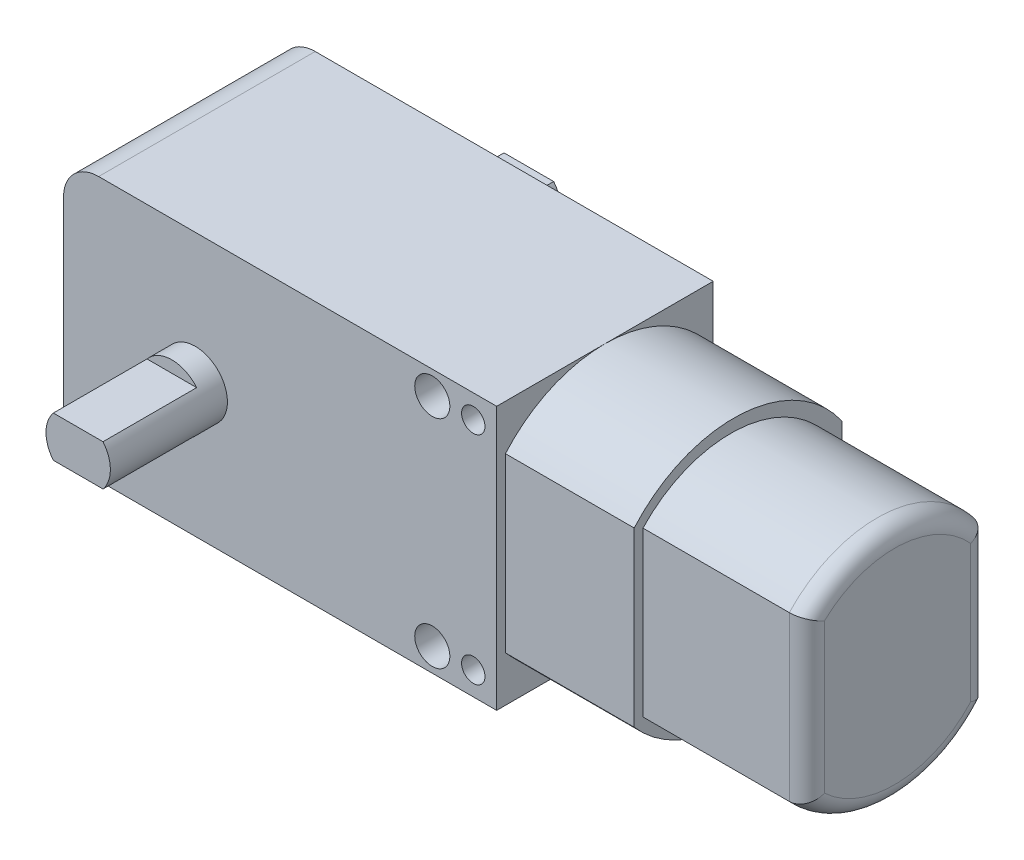
from build123d import *

# Parameters (mm, degrees)
EXTRUDE_1_DEPTH        = 18.5
ESQUISSE2_R            = 11.25
EXTRUDE_2_DEPTH        = 11
ESQUISSE3_W            = 7.263563502
ESQUISSE3_H            = 23
CUT_EXTRUDE_1_DEPTH    = 11
ESQUISSE4_W            = 3.250647349
ESQUISSE4_H            = 22.420209618
CUT_EXTRUDE_2_DEPTH    = 11
EXTRUDE_3_DEPTH        = 14
FILLET_1634_R          = 1.5
ESQUISSE6_R            = 2.75
EXTRUDE_2111_DEPTH     = 10
ESQUISSE7_W            = 6.523740903
ESQUISSE7_H            = 2.038669032
ESQUISSE7_W_2          = 7.224194277
ESQUISSE7_H_2          = 1.666034325
CUT_EXTRUDE_2259_DEPTH = 8
ESQUISSE8_W            = 3
ESQUISSE8_H            = 5
EXTRUDE_2603_DEPTH     = 4.5
CUT_EXTRUDE_4_REACH    = 71.143
ESQUISSE9_R            = 1
ESQUISSE10_R           = 1.5
ESQUISSE10_R_2         = 1
CUT_EXTRUDE_5_DEPTH    = 18.5
ESQUISSE11_R           = 2
EXTRUDE_4_DEPTH        = 2
FILLET_2_R             = 0.2


with BuildPart() as part:
    # Esquisse1 → Бобышка 1 (new body)
    with BuildSketch(Plane.XY):
        with BuildLine():
            Line((3, 0), (37, 0))
            Line((37, 0), (37, 22.5))
            Line((37, 22.5), (3, 22.5))
            ThreePointArc((3, 22.5), (0.878679656, 21.621320344), (0, 19.5))
            Line((0, 19.5), (0, 3))
            ThreePointArc((0, 3), (0.878679656, 0.878679656), (3, 0))
        make_face()
    extrude(amount=-EXTRUDE_1_DEPTH)

    # Esquisse2 → Бобышка 2 (add)
    with BuildSketch(Plane(origin=(37, 0, 0), x_dir=(0, 0, -1), z_dir=(1, 0, 0))):
        with Locations(Location((9.25, 11.25, 0), (0, 0, 90))):
            Circle(ESQUISSE2_R)
    extrude(amount=EXTRUDE_2_DEPTH)

    # Esquisse3 → Вырез 1 (cut)
    with BuildSketch(Plane(origin=(48, 0, 0), x_dir=(0, 0, -1), z_dir=(1, 0, 0))):
        with Locations((-2.881781751, 11.206610827)):
            Rectangle(ESQUISSE3_W, ESQUISSE3_H)
    extrude(amount=-CUT_EXTRUDE_1_DEPTH, mode=Mode.SUBTRACT)

    # Esquisse4 → Вырез 2 (cut)
    with BuildSketch(Plane(origin=(48, 0, 0), x_dir=(0, 0, -1), z_dir=(1, 0, 0))):
        with Locations((20.125323675, 11.210104809)):
            Rectangle(ESQUISSE4_W, ESQUISSE4_H)
    extrude(amount=-CUT_EXTRUDE_2_DEPTH, mode=Mode.SUBTRACT)

    # Esquisse5 → Бобышка 3 (add)
    with BuildSketch(Plane(origin=(48, 0, 0), x_dir=(0, 0, -1), z_dir=(1, 0, 0))):
        with BuildLine():
            Line((1.5, 18.236594306), (1.5, 4.263405694))
            ThreePointArc((1.5, 4.263405694), (9.382350664, 1.007133801), (17, 4.841997191))
            Line((17, 4.841997191), (17, 17.658002809))
            ThreePointArc((17, 17.658002809), (9.382350664, 21.492866199), (1.5, 18.236594306))
        make_face()
    extrude(amount=EXTRUDE_3_DEPTH)

    # Fillet 1634
    fillet_1634_edges = [part.edges().sort_by_distance(p)[0] for p in [
        (62, 21.492866199, -9.382350664),
        (62, 11.25, -1.5),
        (62, 1.007133801, -9.382350664),
        (62, 11.25, -17),
    ]]
    fillet(fillet_1634_edges, radius=FILLET_1634_R)

    # Esquisse6 → Extrude 2111 (add)
    with BuildSketch(Plane(origin=(0, 0, -18.5), x_dir=(-1, 0, 0), z_dir=(0, 0, -1))):
        with Locations(Location((-11.25, 11.315637883, 0), (0, 0, 180))):
            Circle(ESQUISSE6_R)
    extrude_2111 = extrude(amount=EXTRUDE_2111_DEPTH)

    # Esquisse7 → Cut-Extrude 2259 (cut)
    with BuildSketch(Plane(origin=(0, 0, -28.5), x_dir=(-1, 0, 0), z_dir=(0, 0, -1))):
        with Locations((-11.211063993, 14.084972399)):
            Rectangle(ESQUISSE7_W, ESQUISSE7_H)
        with Locations((-10.860837306, 8.732620721)):
            Rectangle(ESQUISSE7_W_2, ESQUISSE7_H_2)
    cut_extrude_2259 = extrude(amount=-CUT_EXTRUDE_2259_DEPTH, mode=Mode.SUBTRACT)

    # Mirror 2388: Extrude 2111, Cut-Extrude 2259 across plane
    add(extrude_2111.mirror(Plane(origin=(0, 0, -9.25), x_dir=(1, 0, 0), z_dir=(0, 0, -1))))
    add(cut_extrude_2259.mirror(Plane(origin=(0, 0, -9.25), x_dir=(1, 0, 0), z_dir=(0, 0, -1))), mode=Mode.SUBTRACT)

    # Esquisse8 → Extrude 2603 (add)
    with BuildSketch(Plane.ZY):
        with Locations((-9.25, 11.5)):
            Rectangle(ESQUISSE8_W, ESQUISSE8_H)
    extrude(amount=EXTRUDE_2603_DEPTH)

    # Esquisse9 → Вырез 4 (cut, up to next)
    with BuildSketch(Plane.XY.offset(-7.75), mode=Mode.PRIVATE) as cut_extrude_4_sk1:
        with Locations((-2.25, 11.5)):
            Circle(ESQUISSE9_R)
    cut_extrude_4_tool1 = extrude(cut_extrude_4_sk1.sketch, amount=-CUT_EXTRUDE_4_REACH, mode=Mode.PRIVATE) & part.part
    add(cut_extrude_4_tool1.solids().sort_by_distance((-2.25, 11.5, -7.75))[0], mode=Mode.SUBTRACT)

    # Esquisse10 → Вырез 5 (cut)
    with BuildSketch(Plane(origin=(0, 0, -18.5), x_dir=(-1, 0, 0), z_dir=(0, 0, -1))):
        with Locations((-31.5, 20.5)):
            Circle(ESQUISSE10_R)
        with Locations((-31.5, 2)):
            Circle(ESQUISSE10_R)
        with Locations((-35, 20.5)):
            Circle(ESQUISSE10_R_2)
        with Locations((-35, 2)):
            Circle(ESQUISSE10_R_2)
    extrude(amount=-CUT_EXTRUDE_5_DEPTH, mode=Mode.SUBTRACT)

    # Esquisse11 → Бобышка 4 (add)
    with BuildSketch(Plane(origin=(0, 0, -18.5), x_dir=(-1, 0, 0), z_dir=(0, 0, -1))):
        with Locations(Location((-22, 11.315637883, 0), (0, 0, 180))):
            Circle(ESQUISSE11_R)
    extrude(amount=EXTRUDE_4_DEPTH)

    # Скругление 2
    fillet_2_edges = [part.edges().sort_by_distance(p)[0] for p in [
        (20, 11.315637883, -20.5),
    ]]
    fillet(fillet_2_edges, radius=FILLET_2_R)


solid = part.part
